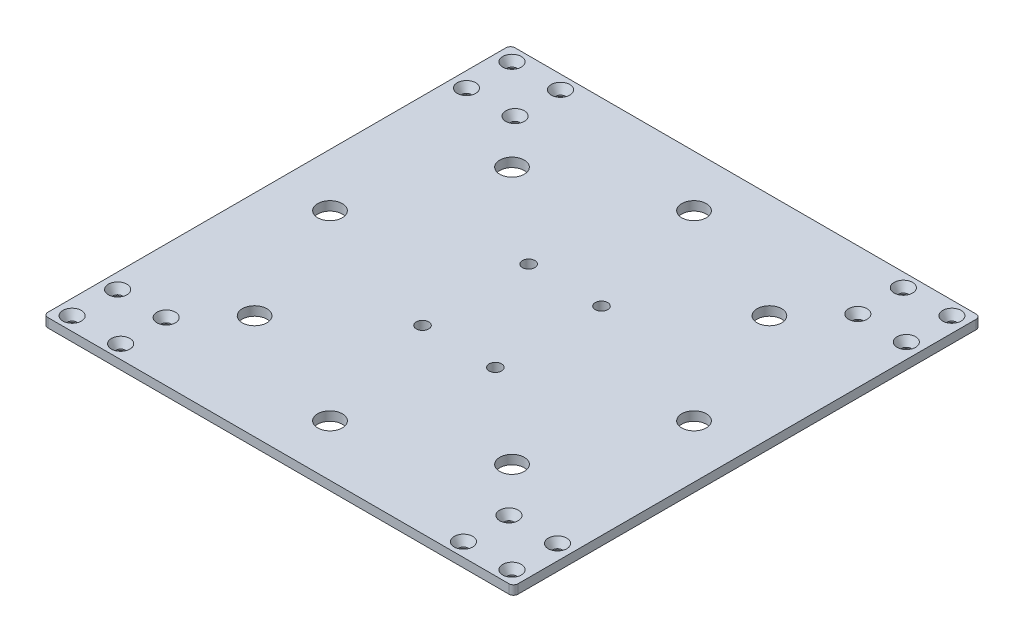
from build123d import *

# Parameters (mm, degrees)
SKETCH_1_W      = 155
SKETCH_1_H      = 154
SKETCH_1_R      = 1.55
SKETCH_1_R_2    = 2.05
SKETCH_1_R_3    = 4.05
EXTRUDE_1_DEPTH = 3
FILLET_1_R      = 1.5
CHAMFER_1_SIZE  = 1.5
CHAMFER_1_SIZE2 = 2.598076211


with BuildPart() as part:
    # 草图1 → 凸台-拉伸1 (new body)
    with BuildSketch(Plane(origin=(0, 0, 0), x_dir=(1, 0, 0), z_dir=(0, 1, 0))):
        Rectangle(SKETCH_1_W, SKETCH_1_H)
        with Locations(Location((56.5, 72.5, 0), (0, 0, 270))):
            Circle(SKETCH_1_R, mode=Mode.SUBTRACT)
        with Locations(Location((72.5, 72.5, 0), (0, 0, 270))):
            Circle(SKETCH_1_R, mode=Mode.SUBTRACT)
        with Locations(Location((72.5, 57.5, 0), (0, 0, 90))):
            Circle(SKETCH_1_R, mode=Mode.SUBTRACT)
        with Locations(Location((56.5, 57.5, 0), (0, 0, 90))):
            Circle(SKETCH_1_R, mode=Mode.SUBTRACT)
        with Locations(Location((-56.5, 57.5, 0), (0, 0, 270))):
            Circle(SKETCH_1_R, mode=Mode.SUBTRACT)
        with Locations(Location((-72.5, 57.5, 0), (0, 0, 270))):
            Circle(SKETCH_1_R, mode=Mode.SUBTRACT)
        with Locations(Location((-72.5, 72.5, 0), (0, 0, 90))):
            Circle(SKETCH_1_R, mode=Mode.SUBTRACT)
        with Locations(Location((-56.5, 72.5, 0), (0, 0, 90))):
            Circle(SKETCH_1_R, mode=Mode.SUBTRACT)
        with Locations(Location((56.5, -57.5, 0), (0, 0, 270))):
            Circle(SKETCH_1_R, mode=Mode.SUBTRACT)
        with Locations(Location((72.5, -57.5, 0), (0, 0, 270))):
            Circle(SKETCH_1_R, mode=Mode.SUBTRACT)
        with Locations(Location((72.5, -72.5, 0), (0, 0, 90))):
            Circle(SKETCH_1_R, mode=Mode.SUBTRACT)
        with Locations(Location((56.5, -72.5, 0), (0, 0, 90))):
            Circle(SKETCH_1_R, mode=Mode.SUBTRACT)
        with Locations(Location((-56.5, -57.5, 0), (0, 0, 90))):
            Circle(SKETCH_1_R, mode=Mode.SUBTRACT)
        with Locations(Location((-72.5, -57.5, 0), (0, 0, 90))):
            Circle(SKETCH_1_R, mode=Mode.SUBTRACT)
        with Locations(Location((-56.5, -72.5, 0), (0, 0, 270))):
            Circle(SKETCH_1_R, mode=Mode.SUBTRACT)
        with Locations(Location((-72.5, -72.5, 0), (0, 0, 270))):
            Circle(SKETCH_1_R, mode=Mode.SUBTRACT)
        with Locations(Location((-12, 17.5, 0), (0, 0, 270))):
            Circle(SKETCH_1_R_2, mode=Mode.SUBTRACT)
        with Locations(Location((12, 17.5, 0), (0, 0, 270))):
            Circle(SKETCH_1_R_2, mode=Mode.SUBTRACT)
        with Locations(Location((12, -17.5, 0), (0, 0, 90))):
            Circle(SKETCH_1_R_2, mode=Mode.SUBTRACT)
        with Locations(Location((-12, -17.5, 0), (0, 0, 90))):
            Circle(SKETCH_1_R_2, mode=Mode.SUBTRACT)
        with Locations(Location((60, 0, 0), (0, 0, 270))):
            Circle(SKETCH_1_R_3, mode=Mode.SUBTRACT)
        with Locations(Location((42.426406871, -42.426406871, 0), (0, 0, 270))):
            Circle(SKETCH_1_R_3, mode=Mode.SUBTRACT)
        with Locations(Location((0, -60, 0), (0, 0, 270))):
            Circle(SKETCH_1_R_3, mode=Mode.SUBTRACT)
        with Locations(Location((-42.426406871, -42.426406871, 0), (0, 0, 270))):
            Circle(SKETCH_1_R_3, mode=Mode.SUBTRACT)
        with Locations(Location((-60, 0, 0), (0, 0, 270))):
            Circle(SKETCH_1_R_3, mode=Mode.SUBTRACT)
        with Locations(Location((-42.426406871, 42.426406871, 0), (0, 0, 270))):
            Circle(SKETCH_1_R_3, mode=Mode.SUBTRACT)
        with Locations(Location((0, 60, 0), (0, 0, 270))):
            Circle(SKETCH_1_R_3, mode=Mode.SUBTRACT)
        with Locations(Location((42.426406871, 42.426406871, 0), (0, 0, 270))):
            Circle(SKETCH_1_R_3, mode=Mode.SUBTRACT)
    extrude(amount=EXTRUDE_1_DEPTH)

    # 圆角1
    fillet_1_edges = [part.edges().sort_by_distance(p)[0] for p in [
        (-77.5, 1.5, -77),
        (77.5, 1.5, -77),
        (77.5, 1.5, 77),
        (-77.5, 1.5, 77),
    ]]
    fillet(fillet_1_edges, radius=FILLET_1_R)

    # 倒角1
    chamfer_1_edges = [part.edges().sort_by_distance(p)[0] for p in [
        (72.5, 3, -74.05),
        (72.5, 3, -55.95),
        (56.5, 3, -74.05),
        (56.5, 3, -55.95),
        (-56.5, 3, -59.05),
        (-72.5, 3, -59.05),
        (-72.5, 3, -70.95),
        (-56.5, 3, -70.95),
        (56.5, 3, 55.95),
        (72.5, 3, 55.95),
        (72.5, 3, 74.05),
        (56.5, 3, 74.05),
        (-56.5, 3, 59.05),
        (-72.5, 3, 59.05),
        (-56.5, 3, 70.95),
        (-72.5, 3, 70.95),
    ]]
    chamfer_1_side = [part.faces().sort_by_distance(p)[0] for p in [
        (0, 3, 0),
    ]]
    chamfer(chamfer_1_edges, length=CHAMFER_1_SIZE, length2=CHAMFER_1_SIZE2, reference=chamfer_1_side[0])


solid = part.part
